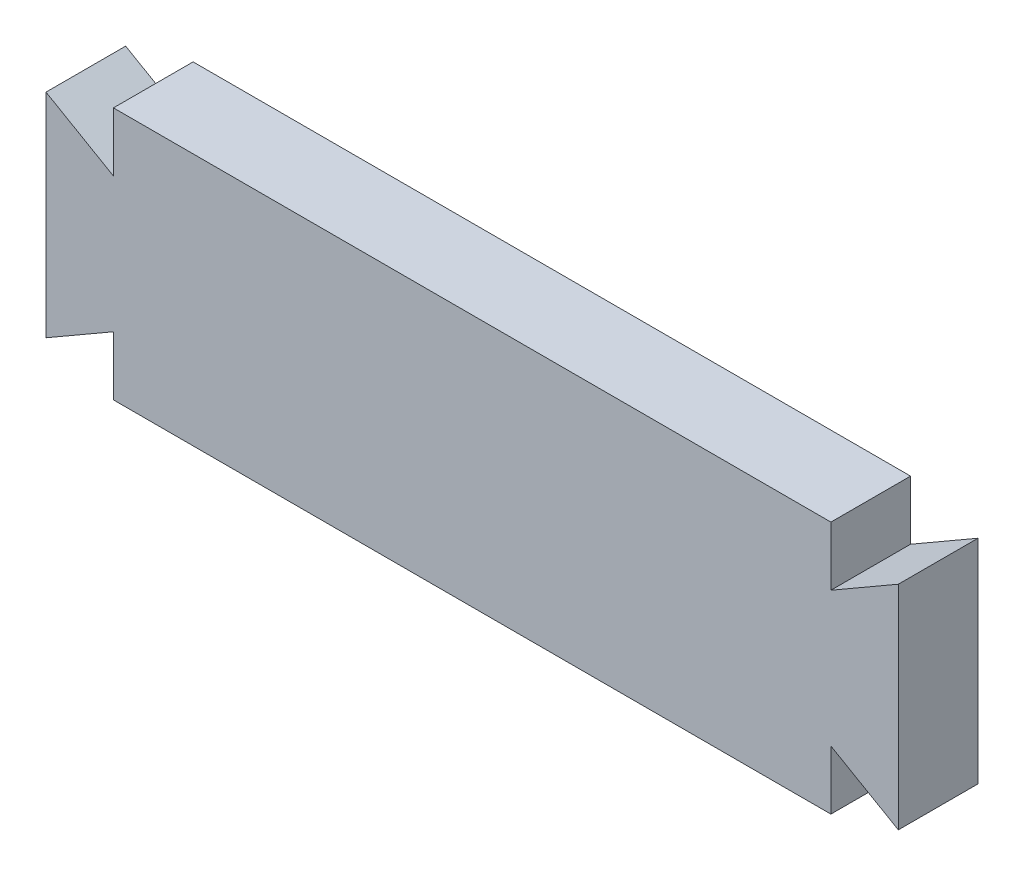
from build123d import *

# Parameters (mm, degrees)
BOSS_EXTRUDE1_DEPTH = 1.500000048


with BuildPart() as part:
    # Sketch1 → Boss-Extrude1 (new, symmetric)
    with BuildSketch(Plane.XY):
        Polygon((-16.049999904, -4.006469684), (-16.049999904, 4.006469684), (-13.509999904, 2.54), (-13.509999904, 4.7625), (13.509999904, 4.7625), (13.509999904, 2.54), (16.049999904, 4.006469684), (16.049999904, -4.006469684), (13.509999904, -2.54), (13.509999904, -4.7625), (-13.509999904, -4.7625), (-13.509999904, -2.54), align=None)
    extrude(amount=BOSS_EXTRUDE1_DEPTH, both=True)


solid = part.part
